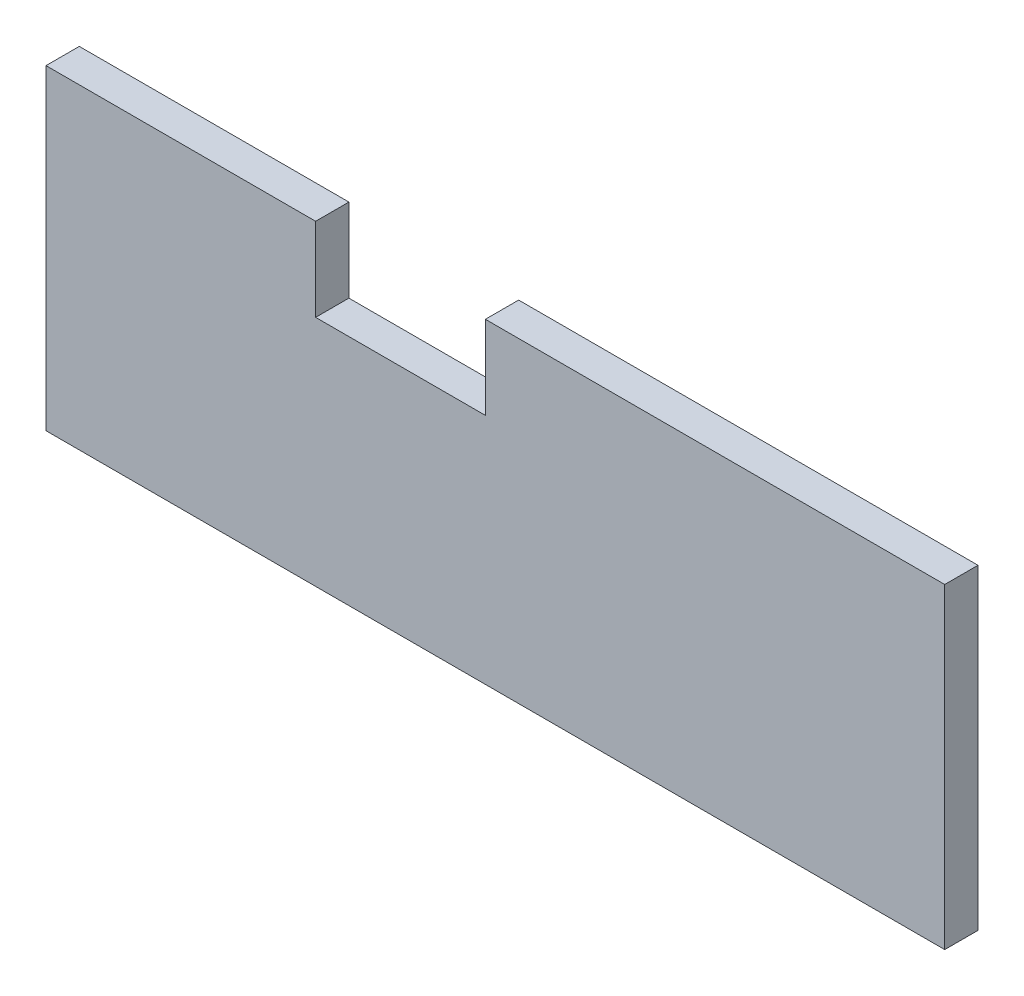
from build123d import *

# Parameters (mm, degrees)
SKETCH1_W           = 270
SKETCH1_H           = 95
BOSS_EXTRUDE1_DEPTH = 5
SKETCH2_W           = 51
SKETCH2_H           = 25
CUT_EXTRUDE1_DEPTH  = 10


with BuildPart() as part:
    # Sketch1 → Boss-Extrude1 (new, symmetric)
    with BuildSketch(Plane.XY):
        Rectangle(SKETCH1_W, SKETCH1_H)
    extrude(amount=BOSS_EXTRUDE1_DEPTH, both=True)

    # Sketch2 → Cut-Extrude1 (cut)
    with BuildSketch(Plane.XY.offset(5)):
        with Locations((-28.5, 35)):
            Rectangle(SKETCH2_W, SKETCH2_H)
    extrude(amount=-CUT_EXTRUDE1_DEPTH, mode=Mode.SUBTRACT)


solid = part.part
